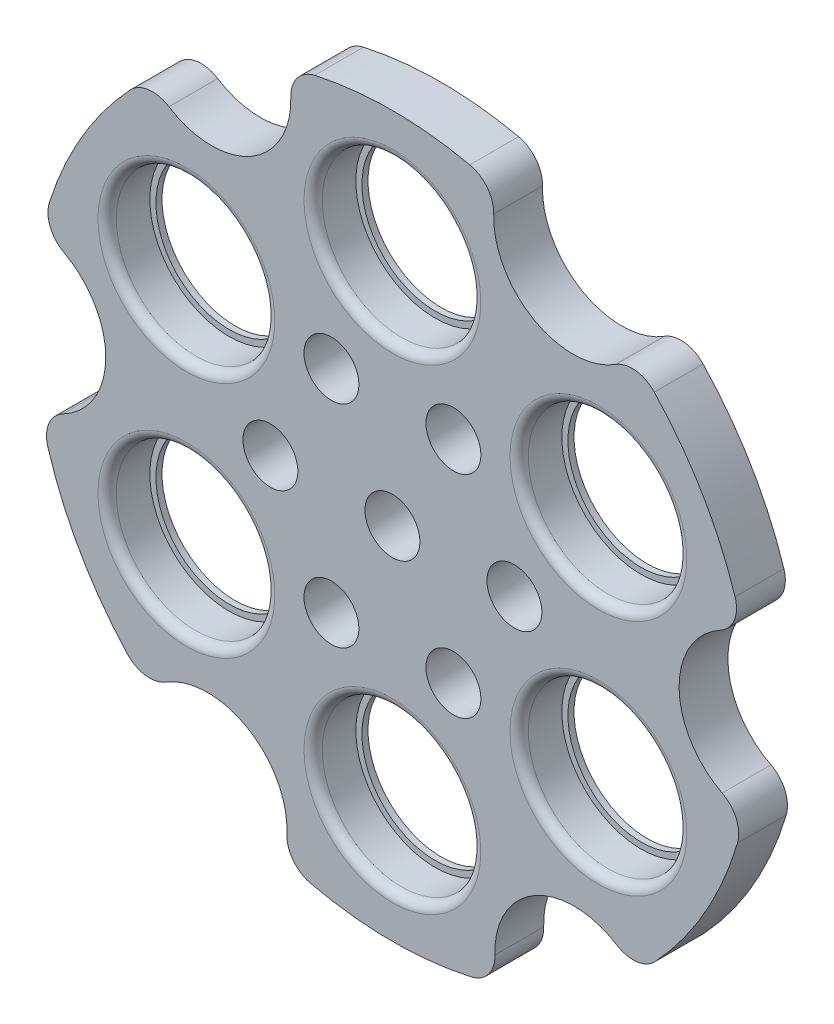
from build123d import *

# Parameters (mm, degrees)
BOSS_EXTRUDE1_DEPTH = 8
SKETCH5_R           = 13
CUT_EXTRUDE2_DEPTH  = 7
SKETCH6_R           = 12
CUT_EXTRUDE4_DEPTH  = 83.938895493
FILLET1_R           = 5
FILLET2_R           = 1.5
SKETCH4_R           = 4.5
CUT_EXTRUDE1_DEPTH  = 83.270653855
SKETCH7_R           = 4.5
CUT_EXTRUDE5_DEPTH  = 83.270653855


with BuildPart() as part:
    # Sketch1 → Boss-Extrude1 (new body)
    with BuildSketch(Plane.XY):
        with BuildLine():
            ThreePointArc((-39.574550046, 43.759056076), (-50.887396651, 29.857542801), (-57.504268194, 13.20072496))
            ThreePointArc((-57.504268194, 13.20072496), (-46.998723421, 0.34640549), (-57.69260283, -12.351662992))
            ThreePointArc((-57.69260283, -12.351662992), (-51.285347011, -29.168702096), (-40.106598397, -43.271939696))
            ThreePointArc((-40.106598397, -43.271939696), (-23.726485127, -40.571589857), (-18.048531105, -56.17161672))
            ThreePointArc((-18.048531105, -56.17161672), (-0.280981547, -58.999330923), (17.512695161, -56.340975393))
            ThreePointArc((17.512695161, -56.340975393), (23.338977049, -40.795736913), (39.692627307, -43.651979766))
            ThreePointArc((39.692627307, -43.651979766), (51.202210273, -29.314393448), (57.739591145, -12.130111886))
            ThreePointArc((57.739591145, -12.130111886), (47.00081495, 0.526301528), (57.453488265, 13.420010664))
            ThreePointArc((57.453488265, 13.420010664), (50.815483372, 29.979770674), (39.531113292, 43.798299989))
            ThreePointArc((39.531113292, 43.798299989), (23.188125092, 40.881668932), (17.304461403, 56.405280033))
            ThreePointArc((17.304461403, 56.405280033), (-0.029269593, 58.99999274), (-17.360417611, 56.388082964))
            ThreePointArc((-17.360417611, 56.388082964), (-23.228676041, 40.858641796), (-39.574550046, 43.759056076))
        make_face()
    extrude(amount=BOSS_EXTRUDE1_DEPTH)

    # Sketch5 → Cut-Extrude2 (cut)
    with BuildSketch(Plane.XY.offset(8)):
        with Locations((0, 39)):
            Circle(SKETCH5_R)
        with Locations((33.774990748, 19.5)):
            Circle(SKETCH5_R)
        with Locations((33.774990748, -19.5)):
            Circle(SKETCH5_R)
        with Locations((0, -39)):
            Circle(SKETCH5_R)
        with Locations((-33.774990748, -19.5)):
            Circle(SKETCH5_R)
        with Locations((-33.774990748, 19.5)):
            Circle(SKETCH5_R)
    extrude(amount=-CUT_EXTRUDE2_DEPTH, mode=Mode.SUBTRACT)

    # Sketch6 → Cut-Extrude4 (cut, through all)
    with BuildSketch(Plane.XY.offset(8)):
        with Locations((0, 39)):
            Circle(SKETCH6_R)
        with Locations((33.774990748, 19.5)):
            Circle(SKETCH6_R)
        with Locations((33.774990748, -19.5)):
            Circle(SKETCH6_R)
        with Locations((0, -39)):
            Circle(SKETCH6_R)
        with Locations((-33.774990748, -19.5)):
            Circle(SKETCH6_R)
        with Locations((-33.774990748, 19.5)):
            Circle(SKETCH6_R)
    extrude(amount=-CUT_EXTRUDE4_DEPTH, mode=Mode.SUBTRACT)

    # Fillet1
    fillet1_edges = [part.edges().sort_by_distance(p)[0] for p in [
        (-57.504268194, 13.20072496, 4),
        (-39.574550046, 43.759056076, 4),
        (-17.360417611, 56.388082964, 4),
        (17.304461403, 56.405280033, 4),
        (39.531113292, 43.798299989, 4),
        (57.453488265, 13.420010664, 4),
        (57.739591145, -12.130111886, 4),
        (39.692627307, -43.651979766, 4),
        (17.512695161, -56.340975393, 4),
        (-18.048531105, -56.17161672, 4),
        (-40.106598397, -43.271939696, 4),
        (-57.69260283, -12.351662992, 4),
    ]]
    fillet(fillet1_edges, radius=FILLET1_R)

    # Fillet2
    fillet2_edges = [part.edges().sort_by_distance(p)[0] for p in [
        (20.774990748, 19.5, 8),
        (20.774990748, -19.5, 8),
        (-13, -39, 8),
        (-46.774990748, -19.5, 8),
        (-46.774990748, 19.5, 8),
        (-13, 39, 8),
    ]]
    fillet(fillet2_edges, radius=FILLET2_R)

    # Sketch4 → Cut-Extrude1 (cut, through all)
    with BuildSketch(Plane(origin=(0, 0, 0), x_dir=(-1, 0, 0), z_dir=(0, 0, -1))):
        Circle(SKETCH4_R)
    extrude(amount=-CUT_EXTRUDE1_DEPTH, mode=Mode.SUBTRACT)

    # Sketch7 → Cut-Extrude5 (cut, through all)
    with BuildSketch(Plane(origin=(0, 0, 0), x_dir=(-1, 0, 0), z_dir=(0, 0, -1))):
        with Locations((-10, 17.320508076)):
            Circle(SKETCH7_R)
        with Locations((10, 17.320508076)):
            Circle(SKETCH7_R)
        with Locations((20, 0)):
            Circle(SKETCH7_R)
        with Locations((10, -17.320508076)):
            Circle(SKETCH7_R)
        with Locations((-10, -17.320508076)):
            Circle(SKETCH7_R)
        with Locations((-20, 0)):
            Circle(SKETCH7_R)
    extrude(amount=-CUT_EXTRUDE5_DEPTH, mode=Mode.SUBTRACT)


solid = part.part
